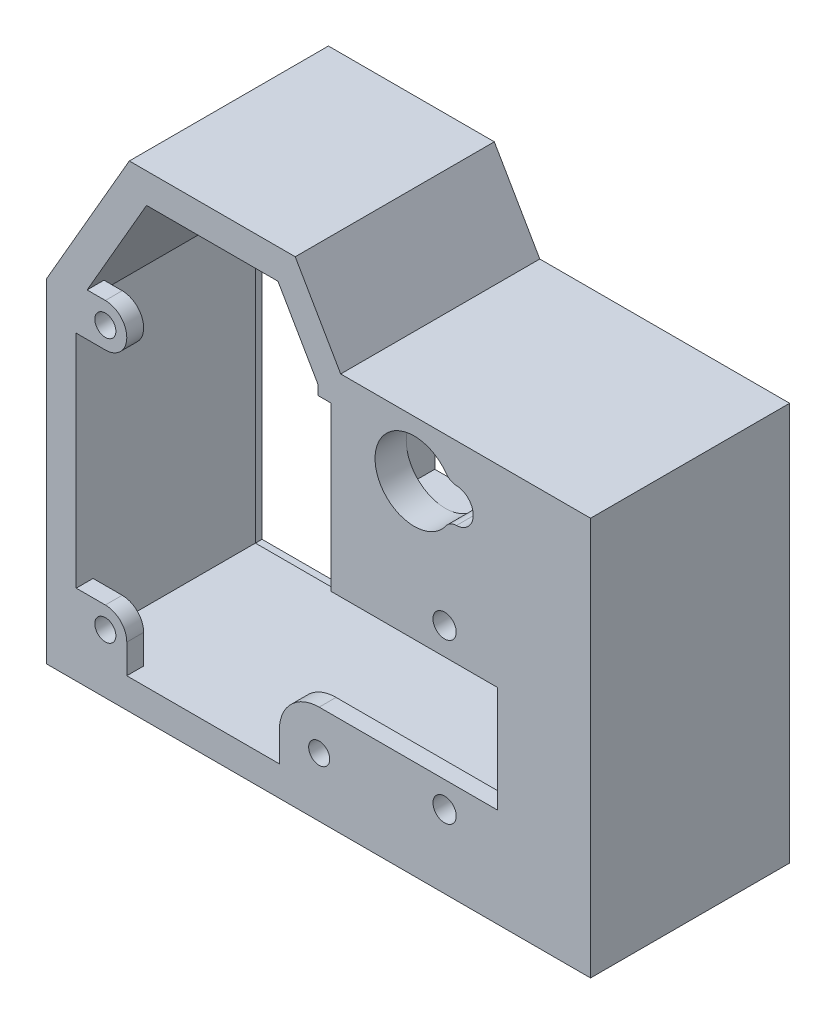
from build123d import *

# Parameters (mm, degrees)
BOSS_EXTRUDE1_DEPTH = 30
CUT_EXTRUDE1_DEPTH  = 59
SKETCH4_W           = 36.590571665
SKETCH4_H           = 16.65
BOSS_EXTRUDE2_DEPTH = 9
SKETCH5_W           = 22.6
SKETCH5_H           = 11.85
CUT_EXTRUDE2_DEPTH  = 4.3
CUT_EXTRUDE3_DEPTH  = 10.2
BOSS_EXTRUDE3_DEPTH = 27
SKETCH9_R           = 1.5875
BOSS_EXTRUDE5_DEPTH = 2.54
SKETCH11_R          = 1.7526
CUT_EXTRUDE4_DEPTH  = 16
FILLET1_R           = 2


with BuildPart() as part:
    # Sketch1 → Boss-Extrude1 (new body)
    with BuildSketch(Plane.XY):
        Polygon((0, 50.21875), (0, 0), (82, 0), (82, 60), (44.352804008, 60), (37.500008496, 71.86939), (12.500002832, 71.86939), align=None)
    extrude(amount=BOSS_EXTRUDE1_DEPTH)

    # Sketch3 → Cut-Extrude1 (cut)
    with BuildSketch(Plane.XY.offset(30)):
        Polygon((42.909428335, 57.5), (36.056632823, 69.36939), (13.943378505, 69.36939), (2.5, 49.548877019), (2.5, 2.5), (79.5, 2.5), (79.5, 57.5), align=None)
    extrude(amount=-CUT_EXTRUDE1_DEPTH, mode=Mode.SUBTRACT)

    # Sketch4 → Boss-Extrude2 (add)
    with BuildSketch(Plane.XY.offset(30)):
        with Locations((61.204714168, 49.175)):
            Rectangle(SKETCH4_W, SKETCH4_H)
    extrude(amount=-BOSS_EXTRUDE2_DEPTH)

    # Sketch5 → Cut-Extrude2 (cut)
    with BuildSketch(Plane(origin=(0, 0, 21), x_dir=(-1, 0, 0), z_dir=(0, 0, -1))):
        with Locations((-60.82763, 51.575)):
            Rectangle(SKETCH5_W, SKETCH5_H)
    extrude(amount=-CUT_EXTRUDE2_DEPTH, mode=Mode.SUBTRACT)

    # Sketch6 → Cut-Extrude3 (cut)
    with BuildSketch(Plane(origin=(0, 0, 25.3), x_dir=(-1, 0, 0), z_dir=(0, 0, -1))):
        with BuildLine():
            Line((-61.72763, 54.15), (-60.723855071, 54.15))
            ThreePointArc((-60.723855071, 54.15), (-49.52763, 51.55), (-60.723855071, 48.95))
            Line((-60.723855071, 48.95), (-61.72763, 48.95))
            ThreePointArc((-61.72763, 48.95), (-64.32763, 51.55), (-61.72763, 54.15))
        make_face()
    extrude(amount=-CUT_EXTRUDE3_DEPTH, mode=Mode.SUBTRACT)

    # Sketch8 → Boss-Extrude3 (add)
    with BuildSketch(Plane.XY.offset(30)):
        Polygon((13.943378505, 69.36939), (2.5, 49.548877019), (2.5, 2.5), (79.5, 2.5), (79.5, 40.85), (77.5, 40.85), (77.5, 4.5), (4.5, 4.5), (4.5, 49.012978634), (15.098079043, 67.36939), (34.901932285, 67.36939), (40.909428335, 56.964101615), (40.909428335, 55.471773493), (42.909428335, 55.471773493), (42.909428335, 57.5), (36.056632823, 69.36939), align=None)
    extrude(amount=-BOSS_EXTRUDE3_DEPTH)

    # Sketch9 → Boss-Extrude5 (add)
    # profile 1 of 3: a face of its own
    with BuildSketch(Plane.XY.offset(30)):
        with BuildLine():
            Line((4.5, 49.012978634), (4.5, 45.39891))
            Line((4.5, 45.39891), (8.89, 45.39891))
            ThreePointArc((8.89, 45.39891), (12.1205, 48.62941), (8.89, 51.85991))
            Line((8.89, 51.85991), (6.14367659, 51.85991))
            Line((6.14367659, 51.85991), (4.5, 49.012978634))
        make_face()
        with Locations((8.89, 48.62941)):
            Circle(SKETCH9_R, mode=Mode.SUBTRACT)
    # profile 2 of 3: a face of its own
    with BuildSketch(Plane.XY.offset(30)):
        with BuildLine():
            Line((4.5, 4.5), (12.1205, 4.5))
            Line((12.1205, 4.5), (12.1205, 8.89))
            ThreePointArc((12.1205, 8.89), (11.174308457, 11.174308457), (8.89, 12.1205))
            Line((8.89, 12.1205), (4.5, 12.1205))
            Line((4.5, 12.1205), (4.5, 4.5))
        make_face()
        with Locations((8.89, 8.89)):
            Circle(SKETCH9_R, mode=Mode.SUBTRACT)
    # profile 3 of 3: a face of its own
    with BuildSketch(Plane.XY.offset(30)):
        with BuildLine():
            Line((77.5, 4.5), (77.5, 40.85))
            Line((77.5, 40.85), (68.00821278, 40.85))
            Line((68.00821278, 40.85), (42.909428335, 40.85))
            Line((42.909428335, 40.85), (42.909428335, 30.90234))
            Line((42.909428335, 30.90234), (68.00821278, 30.90234))
            Line((68.00821278, 30.90234), (68.00821278, 14.90234))
            Line((68.00821278, 14.90234), (44.3405, 14.90234))
            Line((44.3405, 14.90234), (41.11, 14.90234))
            ThreePointArc((41.11, 14.90234), (36.858633615, 13.141366385), (35.09766, 8.89))
            Line((35.09766, 8.89), (35.09766, 4.5))
            Line((35.09766, 4.5), (44.3405, 4.5))
            Line((44.3405, 4.5), (68.00821278, 4.5))
            Line((68.00821278, 4.5), (77.5, 4.5))
        make_face()
        with Locations((41.11, 8.89)):
            Circle(SKETCH9_R, mode=Mode.SUBTRACT)
    extrude(amount=-BOSS_EXTRUDE5_DEPTH)

    # Sketch11 → Cut-Extrude4 (cut)
    with BuildSketch(Plane(origin=(0, 0, 27.46), x_dir=(-1, 0, 0), z_dir=(0, 0, -1))):
        with Locations((-60.00821, 35)):
            Circle(SKETCH11_R)
        with Locations((-60.00821, 11)):
            Circle(SKETCH11_R)
    extrude(amount=-CUT_EXTRUDE4_DEPTH, mode=Mode.SUBTRACT)

    # Fillet1
    fillet1_edges = [part.edges().sort_by_distance(p)[0] for p in [
        (60.723855071, 48.95, 27.65),
        (60.723855071, 54.15, 27.65),
    ]]
    fillet(fillet1_edges, radius=FILLET1_R)


solid = part.part
